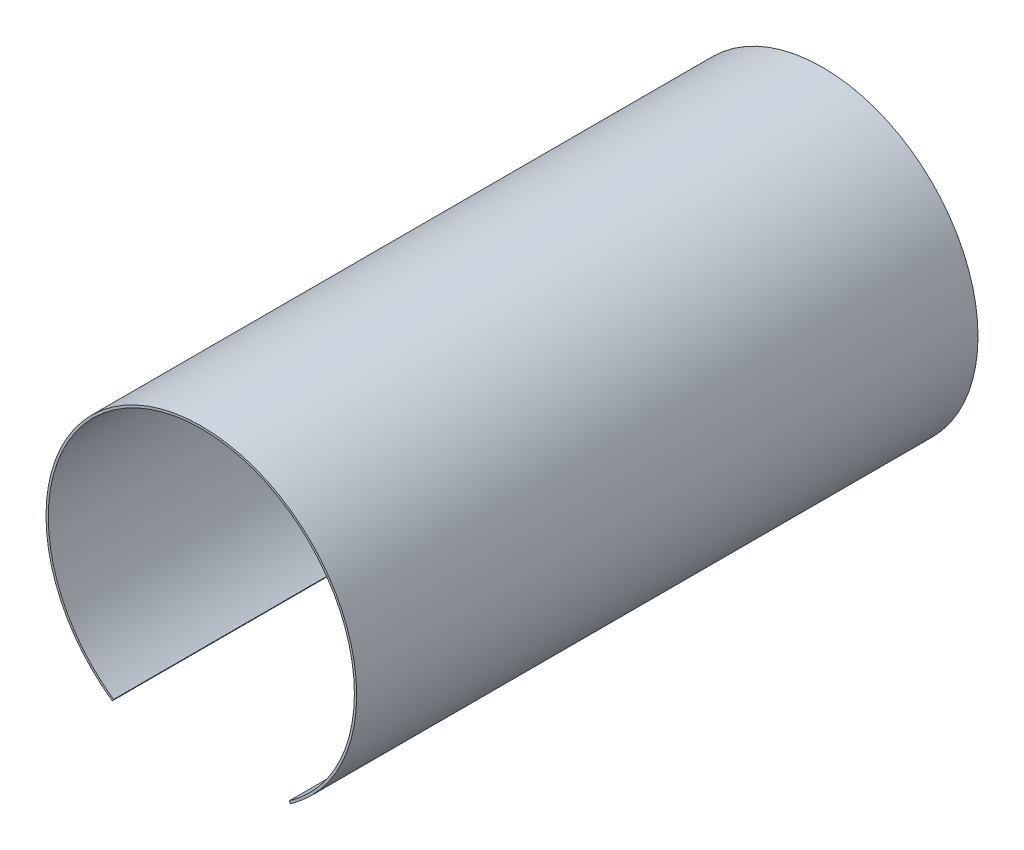
from build123d import *

# Parameters (mm, degrees)
BOSS_EXTRU_1_DEPTH = 410


with BuildPart() as part:
    # Esquisse1 → Boss.-Extru.1 (new body)
    with BuildSketch(Plane.XY):
        with BuildLine():
            Line((-58.791584726, -83.96308454), (-57.931220071, -82.734356473))
            ThreePointArc((-57.931220071, -82.734356473), (0, 101), (57.931220071, -82.734356473))
            Line((57.931220071, -82.734356473), (58.791584726, -83.96308454))
            ThreePointArc((58.791584726, -83.96308454), (0, 102.5), (-58.791584726, -83.96308454))
        make_face()
    extrude(amount=BOSS_EXTRU_1_DEPTH)


solid = part.part
